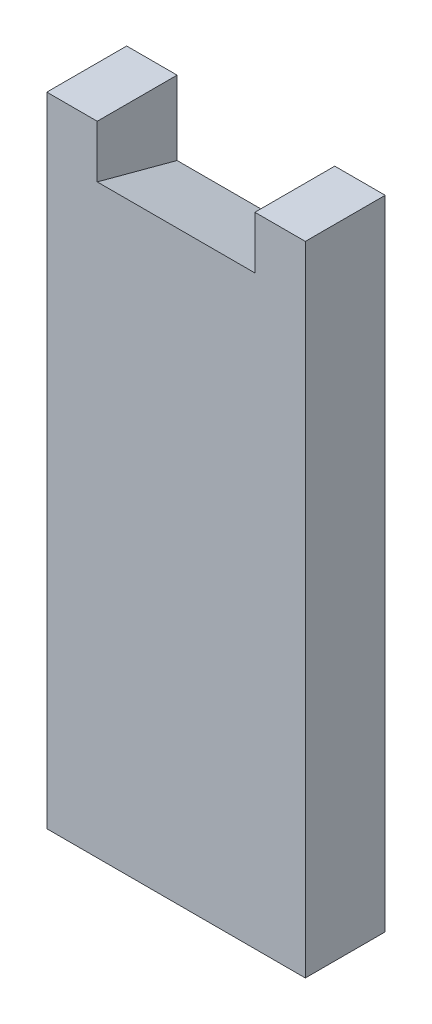
from build123d import *

# Parameters (mm, degrees)
EXTRUDE_1_DEPTH = 7.6
DRAFT_5_ANGLE   = -15


with BuildPart() as part:
    # 草图1 → 凸台-拉伸1 (new body)
    with BuildSketch(Plane.XY):
        Polygon((4.8, 0), (0, 0), (0, -60.7), (24.6, -60.7), (24.6, 0), (19.8, 0), (19.8, -5), (4.8, -5), align=None)
    extrude(amount=EXTRUDE_1_DEPTH)

    # 拔模5
    draft_5_faces = [part.faces().sort_by_distance(p)[0] for p in [
        (12.3, -5, 3.8),
    ]]
    draft(draft_5_faces, Plane.XY.offset(7.6), DRAFT_5_ANGLE)


solid = part.part
